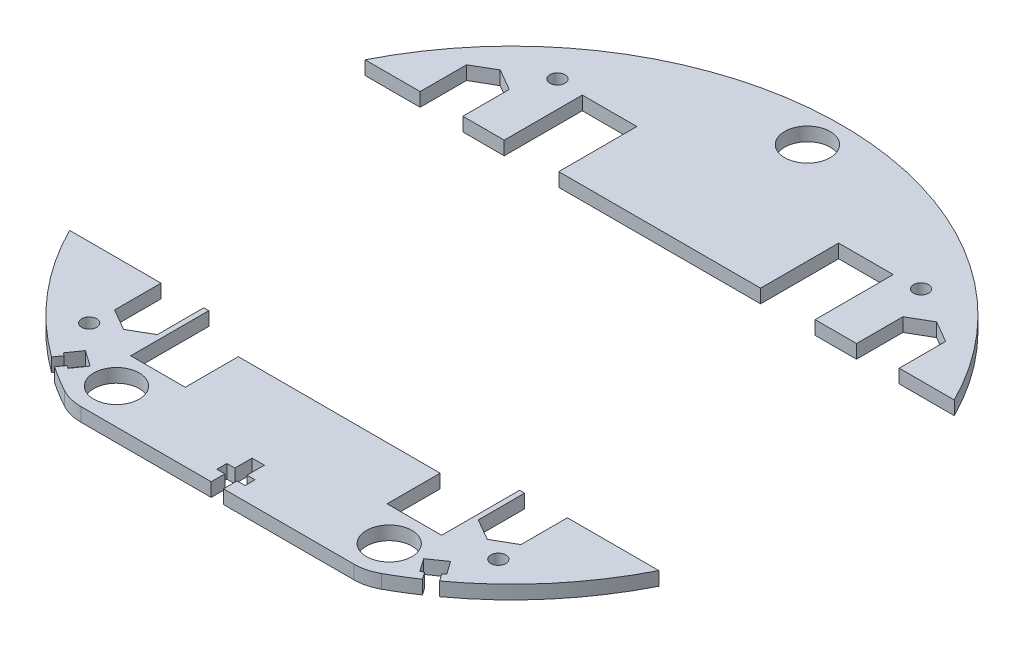
from build123d import *

# Parameters (mm, degrees)
BOSS_EXTRUDE1_DEPTH = 3
CUT_EXTRUDE1_DEPTH  = 103.574363269
CUT_EXTRUDE2_DEPTH  = 103.574363269
SKETCH4_R           = 5
CUT_EXTRUDE3_DEPTH  = 98.289516393
CUT_EXTRUDE4_DEPTH  = 98.289516393
SKETCH7_R           = 5
CUT_EXTRUDE6_DEPTH  = 98.289516393
CUT_EXTRUDE7_DEPTH  = 98.289516393
SKETCH9_R           = 1.65
CUT_EXTRUDE8_DEPTH  = 98.289516393
CUT_EXTRUDE9_DEPTH  = 98.289516393


with BuildPart() as part:
    # Sketch1 → Boss-Extrude1 (new body)
    with BuildSketch(Plane(origin=(0, 0, 0), x_dir=(1, 0, 0), z_dir=(0, 1, 0))):
        with BuildLine():
            Line((-30.029977361, -64.812867647), (30.029977361, -64.812867647))
            ThreePointArc((30.029977361, -64.812867647), (32.509837414, -64.500503794), (34.834773739, -63.582926471))
            ThreePointArc((34.834773739, -63.582926471), (0, 72.5), (-34.834773739, -63.582926471))
            ThreePointArc((-34.834773739, -63.582926471), (-32.509837414, -64.500503794), (-30.029977361, -64.812867647))
        make_face()
    extrude(amount=BOSS_EXTRUDE1_DEPTH)

    # Sketch2 → Cut-Extrude1 (cut, through all)
    with BuildSketch(Plane(origin=(0, 3, 0), x_dir=(1, 0, 0), z_dir=(0, 1, 0))):
        Polygon((-34.2, -49.675685802), (-22.2, -49.675685802), (-22.2, -38), (22.2, -38), (22.2, -49.675685802), (34.2, -49.675685802), (34.2, 49.675685802), (22.2, 49.675685802), (22.2, 32.5), (19, 32.5), (19, 28.2), (-19, 28.2), (-19, 32.5), (-22.2, 32.5), (-22.2, 49.675685802), (-34.2, 49.675685802), align=None)
    extrude(amount=-CUT_EXTRUDE1_DEPTH, mode=Mode.SUBTRACT)

    # Sketch3 → Cut-Extrude2 (cut, through all)
    with BuildSketch(Plane(origin=(0, 3, 0), x_dir=(1, 0, 0), z_dir=(0, 1, 0))):
        Polygon((34.2, -32.5), (-34.2, -32.5), (-72.5, -32.5), (-72.5, 32.5), (-34.2, 32.5), (34.2, 32.5), (72.5, 32.5), (72.5, -32.5), align=None)
    extrude(amount=-CUT_EXTRUDE2_DEPTH, mode=Mode.SUBTRACT)


with BuildPart() as cut_extrude2_piece_1:
    # of the separate pieces the step leaves, piece 1, a body of its own (cut_extrude2_pieces)
    add(part.part.solids().sort_by_distance((64.807406984, 0, -32.5))[0])


with BuildPart() as cut_extrude2_piece_2:
    # of the separate pieces the step leaves, piece 2, a body of its own (cut_extrude2_pieces)
    add(part.part.solids().sort_by_distance((-34.834773739, 0, 63.582926471))[0])

    # Sketch4 → Cut-Extrude3 (cut, through all)
    with BuildSketch(Plane(origin=(0, 3, 0), x_dir=(1, 0, 0), z_dir=(0, 1, 0))):
        with Locations(Location((30, -57, 0), (0, 0, 90))):
            Circle(SKETCH4_R)
        with Locations(Location((-30, -57, 0), (0, 0, 270))):
            Circle(SKETCH4_R)
    extrude(amount=-CUT_EXTRUDE3_DEPTH, mode=Mode.SUBTRACT)


with BuildPart() as cut_extrude4_tool:
    # Sketch5 → Cut-Extrude4 (new, through all)
    with BuildSketch(Plane(origin=(0, 3, 0), x_dir=(1, 0, 0), z_dir=(0, 1, 0))):
        Polygon((-52.7, 37.286453735), (-52.7, 32.5), (-43.3, 32.5), (-43.3, 37.286453735), (-43.3, 42.713546265), (-48, 45.42709253), (-52.7, 42.713546265), align=None)
        Polygon((-44.7, -37.286453735), (-44.7, -32.5), (-35.3, -32.5), (-35.3, -37.286453735), (-35.3, -42.713546265), (-40, -45.42709253), (-44.7, -42.713546265), align=None)
        Polygon((35.3, -32.5), (44.7, -32.5), (44.7, -37.286453735), (44.7, -42.713546265), (40, -45.42709253), (35.3, -42.713546265), (35.3, -37.286453735), align=None)
        Polygon((43.3, 37.286453735), (43.3, 42.713546265), (48, 45.42709253), (52.7, 42.713546265), (52.7, 37.286453735), (52.7, 32.5), (43.3, 32.5), align=None)
    extrude(amount=-CUT_EXTRUDE4_DEPTH)


with BuildPart() as cut_extrude2_piece_1_1:
    add(cut_extrude2_piece_1.part)

    # Cut-Extrude4: cut by cut_extrude4_tool
    add(cut_extrude4_tool.part, mode=Mode.SUBTRACT)

    # Sketch7 → Cut-Extrude6 (cut, through all)
    with BuildSketch(Plane(origin=(0, 3, 0), x_dir=(1, 0, 0), z_dir=(0, 1, 0))):
        with Locations(Location((0, 65, 0), (0, 0, 270))):
            Circle(SKETCH7_R)
    extrude(amount=-CUT_EXTRUDE6_DEPTH, mode=Mode.SUBTRACT)


with BuildPart() as cut_extrude2_piece_2_1:
    add(cut_extrude2_piece_2.part)

    # Cut-Extrude4: cut by cut_extrude4_tool
    add(cut_extrude4_tool.part, mode=Mode.SUBTRACT)

    # Sketch8 → Cut-Extrude7 (cut, through all)
    with BuildSketch(Plane(origin=(0, 3, 0), x_dir=(1, 0, 0), z_dir=(0, 1, 0))):
        Polygon((-1.35, -64.812867647), (-1.35, -61.812867647), (-3.1, -61.812867647), (-3.1, -59.612867647), (-1.35, -59.612867647), (-1.35, -55.812867647), (1.35, -55.812867647), (1.35, -59.612867647), (3.1, -59.612867647), (3.1, -61.812867647), (1.35, -61.812867647), (1.35, -64.812867647), align=None)
    extrude(amount=-CUT_EXTRUDE7_DEPTH, mode=Mode.SUBTRACT)


with BuildPart() as cut_extrude8_tool:
    # Sketch9 → Cut-Extrude8 (new, through all)
    with BuildSketch(Plane(origin=(0, 3, 0), x_dir=(1, 0, 0), z_dir=(0, 1, 0))):
        with Locations(Location((45, -48, 0), (0, 0, 270))):
            Circle(SKETCH9_R)
        with Locations(Location((-45, -48, 0), (0, 0, 90))):
            Circle(SKETCH9_R)
        with Locations(Location((40, 50, 0), (0, 0, 270))):
            Circle(SKETCH9_R)
        with Locations(Location((-40, 50, 0), (0, 0, 90))):
            Circle(SKETCH9_R)
    extrude(amount=-CUT_EXTRUDE8_DEPTH)


with BuildPart() as cut_extrude2_piece_1_2:
    add(cut_extrude2_piece_1_1.part)

    # Cut-Extrude8: cut by cut_extrude8_tool
    add(cut_extrude8_tool.part, mode=Mode.SUBTRACT)


with BuildPart() as cut_extrude2_piece_2_2:
    add(cut_extrude2_piece_2_1.part)

    # Cut-Extrude8: cut by cut_extrude8_tool
    add(cut_extrude8_tool.part, mode=Mode.SUBTRACT)

    # Sketch10 → Cut-Extrude9 (cut, through all)
    with BuildSketch(Plane(origin=(0, 3, 0), x_dir=(1, 0, 0), z_dir=(0, 1, 0))):
        Polygon((36.688923141, -56.102036895), (40.17031933, -53.66433704), (42.177836857, -56.531369195), (41.542994023, -56.975890933), (42.690146895, -58.614195022), (40.478436376, -60.1628514), (39.331283503, -58.524547311), (38.696440669, -58.96906905), align=None)
        Polygon((-41.542994023, -56.975890933), (-42.177836857, -56.531369195), (-40.17031933, -53.66433704), (-36.688923141, -56.102036895), (-38.696440669, -58.96906905), (-39.331283503, -58.524547311), (-40.478436376, -60.1628514), (-42.690146895, -58.614195022), align=None)
    extrude(amount=-CUT_EXTRUDE9_DEPTH, mode=Mode.SUBTRACT)


solid = Compound([cut_extrude2_piece_1_2.part, cut_extrude2_piece_2_2.part])
